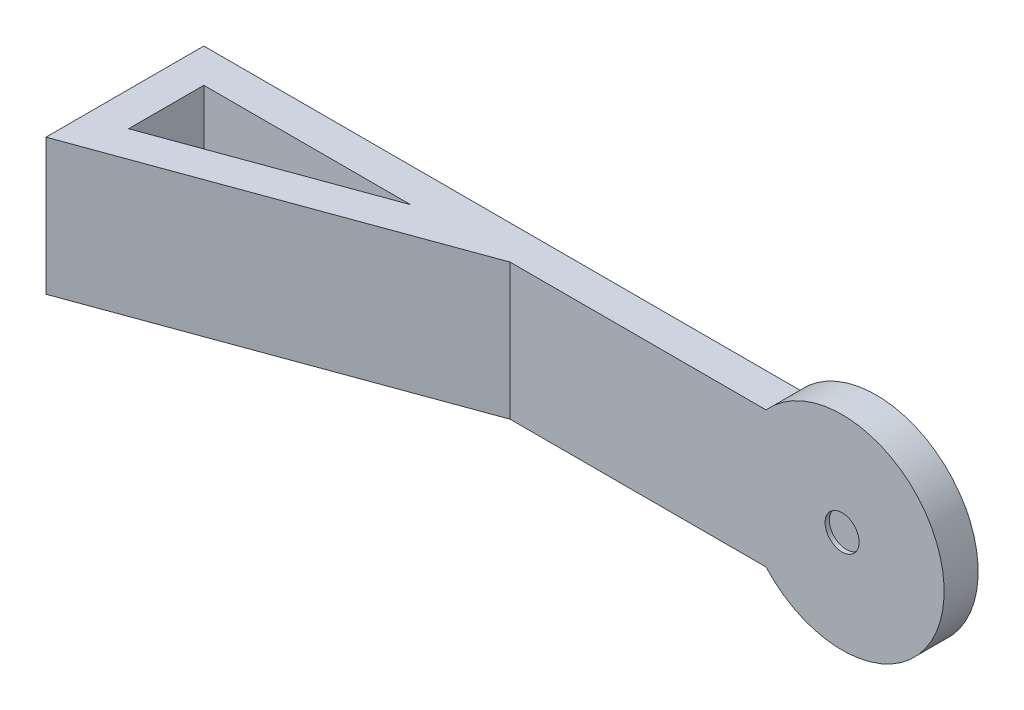
from build123d import *

# Parameters (mm, degrees)
BOSS_EXTRUDE1_DEPTH   = 25.4
SKETCH3_R             = 19.05
SKETCH3_R_2           = 3.175
BOSS_EXTRUDE2_DEPTH   = 6.35
CUT_EXTRUDE1_DEPTH    = 25.4
BOSS_EXTRUDE3_START   = -0.79375
BOSS_EXTRUDE3_DEPTH   = 4.7625
BODY_MOVE_COPY1_ANGLE = 90


with BuildPart() as part:
    # Sketch2 → Boss-Extrude1 (new body)
    with BuildSketch(Plane.XY):
        Polygon((0, 0), (0, 29.462109876), (63.5, 6.35), (139.7, 6.35), (139.7, 0), align=None)
        Polygon((44.933842059, 6.35), (6.35, 6.35), (6.35, 20.393370033), align=None, mode=Mode.SUBTRACT)
    extrude(amount=BOSS_EXTRUDE1_DEPTH)

    # Sketch3 → Boss-Extrude2 (add)
    with BuildSketch(Plane(origin=(0, 6.35, 0), x_dir=(1, 0, 0), z_dir=(0, 1, 0))):
        with Locations((125.500968343, -12.7)):
            Circle(SKETCH3_R)
        with Locations((125.500968343, -12.7)):
            Circle(SKETCH3_R_2, mode=Mode.SUBTRACT)
    extrude(amount=-BOSS_EXTRUDE2_DEPTH)

    # Sketch3<2> → Cut-Extrude1 (cut)
    with BuildSketch(Plane(origin=(0, 6.35, 0), x_dir=(1, 0, 0), z_dir=(0, 1, 0))):
        with BuildLine():
            ThreePointArc((122.325968343, -12.7), (125.500968343, -15.875), (128.675968343, -12.7))
            Line((128.675968343, -12.7), (122.325968343, -12.7))
        make_face()
        with BuildLine():
            Line((122.325968343, -12.7), (128.675968343, -12.7))
            ThreePointArc((128.675968343, -12.7), (125.500968343, -9.525), (122.325968343, -12.7))
        make_face()
    extrude(amount=-CUT_EXTRUDE1_DEPTH, mode=Mode.SUBTRACT)

    # Sketch3<3> → Boss-Extrude3 (add)
    with BuildSketch(Plane(origin=(0, 6.35, 0), x_dir=(1, 0, 0), z_dir=(0, 1, 0)).offset(BOSS_EXTRUDE3_START)):
        with BuildLine():
            ThreePointArc((122.325968343, -12.7), (125.500968343, -15.875), (128.675968343, -12.7))
            Line((128.675968343, -12.7), (122.325968343, -12.7))
        make_face()
        with BuildLine():
            Line((122.325968343, -12.7), (128.675968343, -12.7))
            ThreePointArc((128.675968343, -12.7), (125.500968343, -9.525), (122.325968343, -12.7))
        make_face()
    extrude(amount=-BOSS_EXTRUDE3_DEPTH)


with BuildPart() as part_1:
    # Body-Move/Copy1: moved
    add(part.part.rotate(Axis((0, 0, 0), (1, 0, 0)), BODY_MOVE_COPY1_ANGLE))


solid = part_1.part
